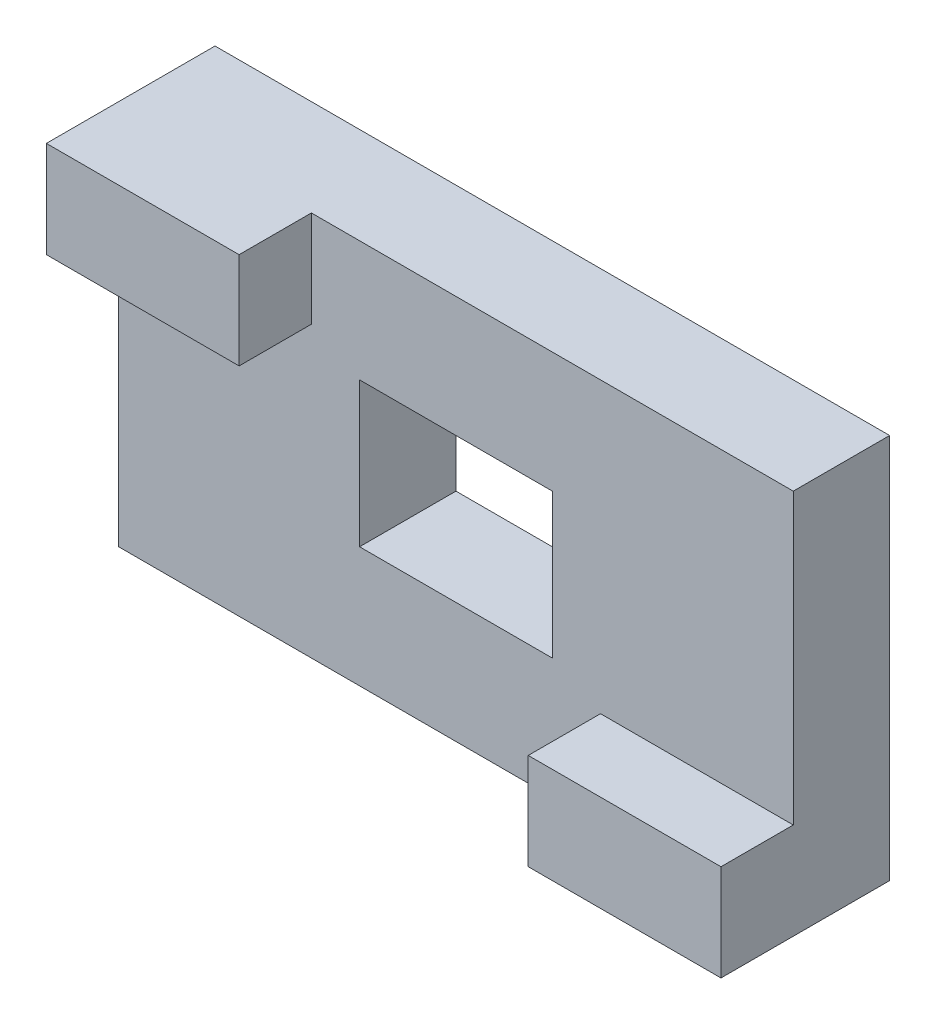
from build123d import *

# Parameters (mm, degrees)
SKETCH1_W           = 56
SKETCH1_H           = 32
SKETCH1_W_2         = 16
SKETCH1_H_2         = 12
BOSS_EXTRUDE1_DEPTH = 4
SKETCH2_W           = 16
SKETCH2_H           = 8
BOSS_EXTRUDE3_DEPTH = 6


with BuildPart() as part:
    # Sketch1 → Boss-Extrude1 (new, symmetric)
    with BuildSketch(Plane.XY):
        with Locations((-28, 16)):
            Rectangle(SKETCH1_W, SKETCH1_H)
        with Locations((-28, 16)):
            Rectangle(SKETCH1_W_2, SKETCH1_H_2, mode=Mode.SUBTRACT)
    extrude(amount=BOSS_EXTRUDE1_DEPTH, both=True)

    # Sketch2 → Boss-Extrude3 (add, symmetric)
    with BuildSketch(Plane.XY.offset(4)):
        with Locations((-48, 28)):
            Rectangle(SKETCH2_W, SKETCH2_H)
        with Locations((-8, 4)):
            Rectangle(SKETCH2_W, SKETCH2_H)
    extrude(amount=BOSS_EXTRUDE3_DEPTH, both=True)


solid = part.part
